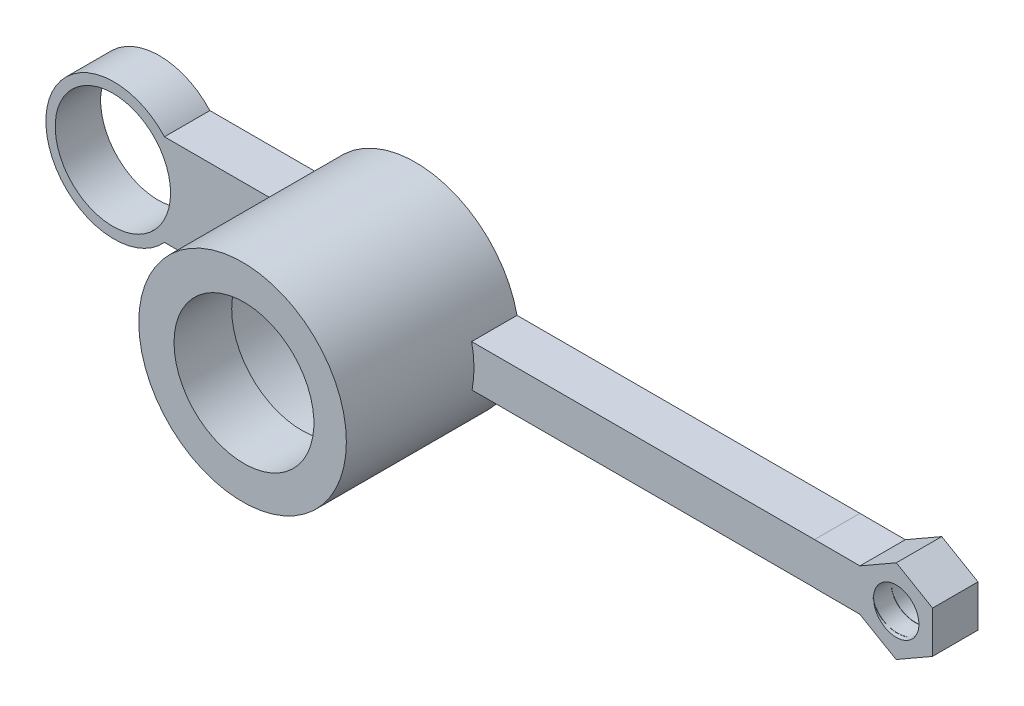
from build123d import *

# Parameters (mm, degrees)
BOSS_EXTRUDE1_DEPTH     = 10
CUT_EXTRUDE1_DEPTH      = 10
CUT_EXTRUDE1_DEPTH_BACK = 10
SKETCH2_R               = 5
CUT_SWEEP1_PITCH        = 4
CUT_SWEEP1_HEIGHT       = 10
CUT_SWEEP1_RADIUS       = 5
EXTRUDE_THIN2_DEPTH     = 10
BODY_MOVE_COPY1_ANGLE   = 2
SKETCH10_W              = 73.109037791
SKETCH10_H              = 9.197874715
BOSS_EXTRUDE2_DEPTH     = 10
SKETCH14_W              = 2.398597497
SKETCH14_H              = 9.211550244
BOSS_EXTRUDE7_DEPTH     = 10
SKETCH14_3_R            = 22.86
BOSS_EXTRUDE8_DEPTH     = 38.1
CUT_EXTRUDE2_DEPTH      = 25.4
CUT_EXTRUDE2_DEPTH_BACK = 38.1
SKETCH15_R              = 20.32
CUT_EXTRUDE3_DEPTH      = 38.1
CUT_EXTRUDE3_DEPTH_BACK = 38.1
SKETCH16_R              = 15.4
SKETCH17_W              = 25.201116709
SKETCH17_H              = 20.14431591
BOSS_EXTRUDE9_DEPTH     = 10
SKETCH19_R              = 15
BOSS_EXTRUDE10_DEPTH    = 10
CUT_EXTRUDE4_DEPTH      = 10
CUT_EXTRUDE4_DEPTH_BACK = 10
SKETCH20_R              = 12.7


with BuildPart() as part:
    # Sketch1 → Boss-Extrude1 (new body)
    with BuildSketch(Plane.XY):
        Polygon((-8.167579482, -4.315550803), (-0.346413115, -9.231106721), (7.821166368, -4.915555918), (8.167579482, 4.315550803), (0.346413115, 9.231106721), (-7.821166368, 4.915555918), align=None)
    extrude(amount=BOSS_EXTRUDE1_DEPTH)

    # Sketch2 → Cut-Extrude1 (cut, two sides: drawn at the far end of the back side and taken through both)
    with BuildSketch(Plane.XY.offset(-CUT_EXTRUDE1_DEPTH_BACK)):
        Circle(SKETCH2_R)
    extrude(amount=CUT_EXTRUDE1_DEPTH + CUT_EXTRUDE1_DEPTH_BACK, mode=Mode.SUBTRACT)

    # Cut-Sweep1: sweep along a helix
    with BuildLine() as cut_sweep1_path:
        Helix(CUT_SWEEP1_PITCH, CUT_SWEEP1_HEIGHT, CUT_SWEEP1_RADIUS, center=(0, 0, 0), direction=(0, 0, 1), lefthand=True)
    # Sketch4 → Cut-Sweep1 (sweep, cut)
    with BuildSketch(Plane.XY):
        Polygon((5.337109255, 0), (4.831445373, 0.291945178), (4.831445373, -0.291945178), align=None)
    sweep(path=cut_sweep1_path.line, is_frenet=True, mode=Mode.SUBTRACT)

    # Sketch6 → Extrude-Thin2 (add)
    with BuildSketch(Plane.XY):
        Polygon((-7.821166368, 4.915555918), (-8.167579482, -4.315550803), (-18.160545639, -3.940547606), (-17.814132524, 5.290559115), align=None)
    extrude(amount=EXTRUDE_THIN2_DEPTH)


with BuildPart() as part_1:
    # Body-Move/Copy1: moved
    add(part.part.rotate(Axis((-4.996483078, 0, 0), (0, 0, 1)), BODY_MOVE_COPY1_ANGLE))

    # Sketch10 → Boss-Extrude2 (add)
    with BuildSketch(Plane.XY):
        with Locations((-54.545481105, 0.241069377)):
            Rectangle(SKETCH10_W, SKETCH10_H)
    extrude(amount=BOSS_EXTRUDE2_DEPTH)

    # Sketch14 → Boss-Extrude7 (add)
    with BuildSketch(Plane.XY):
        with Locations((-92.299298749, 0.234231612)):
            Rectangle(SKETCH14_W, SKETCH14_H)
    extrude(amount=BOSS_EXTRUDE7_DEPTH)

    # Sketch14<3> → Boss-Extrude8 (add)
    with BuildSketch(Plane.XY):
        with Locations(Location((-115.84035067, 0, 0), (0, 0, 12.223392191))):
            Circle(SKETCH14_3_R)
    extrude(amount=BOSS_EXTRUDE8_DEPTH)

    # Sketch15 → Cut-Extrude2 (cut, two sides: drawn at the far end of the back side and taken through both)
    with BuildSketch(Plane.XY.offset(-CUT_EXTRUDE2_DEPTH_BACK)):
        with Locations((-115.84035067, 0)):
            Circle(SKETCH15_R)
    extrude(amount=CUT_EXTRUDE2_DEPTH + CUT_EXTRUDE2_DEPTH_BACK, mode=Mode.SUBTRACT)

    # Sketch16 → Cut-Extrude3 (cut, two sides: drawn at the far end of the back side and taken through both)
    with BuildSketch(Plane.XY.offset(-CUT_EXTRUDE3_DEPTH_BACK)):
        with Locations(Location((-115.534237584, 0, 0), (0, 0, 180))):
            Circle(SKETCH16_R)
    extrude(amount=CUT_EXTRUDE3_DEPTH + CUT_EXTRUDE3_DEPTH_BACK, mode=Mode.SUBTRACT)

    # Sketch17 → Boss-Extrude9 (add)
    with BuildSketch(Plane.XY):
        with Locations((-148.962391284, 0)):
            Rectangle(SKETCH17_W, SKETCH17_H)
    extrude(amount=BOSS_EXTRUDE9_DEPTH)

    # Sketch19 → Boss-Extrude10 (add)
    with BuildSketch(Plane.XY):
        with Locations((-172.255338782, 0)):
            Circle(SKETCH19_R)
    extrude(amount=BOSS_EXTRUDE10_DEPTH)

    # Sketch20 → Cut-Extrude4 (cut, two sides: drawn at the far end of the back side and taken through both)
    with BuildSketch(Plane.XY.offset(-CUT_EXTRUDE4_DEPTH_BACK)):
        with Locations((-172.49769937, 0)):
            Circle(SKETCH20_R)
    extrude(amount=CUT_EXTRUDE4_DEPTH + CUT_EXTRUDE4_DEPTH_BACK, mode=Mode.SUBTRACT)


solid = part_1.part
